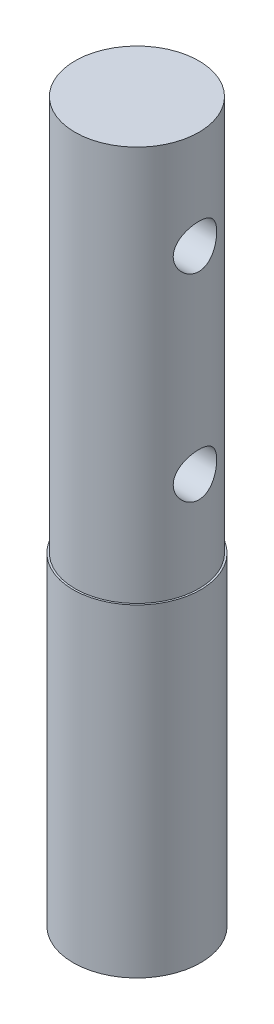
from build123d import *

# Parameters (mm, degrees)
SKETCH1_R               = 32.25
BOSS_EXTRUDE1_DEPTH     = 163.5
SKETCH2_R               = 31.34
BOSS_EXTRUDE2_DEPTH     = 200
CUT_EXTRUDE1_DEPTH      = 367.350071653
CUT_EXTRUDE1_DEPTH_BACK = 367.350071653
SKETCH3_R               = 11


with BuildPart() as part:
    # Sketch1 → Boss-Extrude1 (new body)
    with BuildSketch(Plane(origin=(0, 0, 0), x_dir=(1, 0, 0), z_dir=(0, 1, 0))):
        with Locations(Location((0, 0, 0), (0, 0, 270))):
            Circle(SKETCH1_R)
    extrude(amount=BOSS_EXTRUDE1_DEPTH)

    # Sketch2 → Boss-Extrude2 (add)
    with BuildSketch(Plane(origin=(0, 163.5, 0), x_dir=(1, 0, 0), z_dir=(0, 1, 0))):
        with Locations(Location((0, 0, 0), (0, 0, 270))):
            Circle(SKETCH2_R)
    extrude(amount=BOSS_EXTRUDE2_DEPTH)

    # Sketch3 → Cut-Extrude1 (cut, two sides: drawn at the far end of the back side and taken through both)
    with BuildSketch(Plane(origin=(0, 0, 0), x_dir=(0, 0, -1), z_dir=(1, 0, 0)).offset(-CUT_EXTRUDE1_DEPTH_BACK)):
        with Locations((0, 213.5)):
            Circle(SKETCH3_R)
        with Locations((0, 313.5)):
            Circle(SKETCH3_R)
    extrude(amount=CUT_EXTRUDE1_DEPTH + CUT_EXTRUDE1_DEPTH_BACK, mode=Mode.SUBTRACT)


solid = part.part
